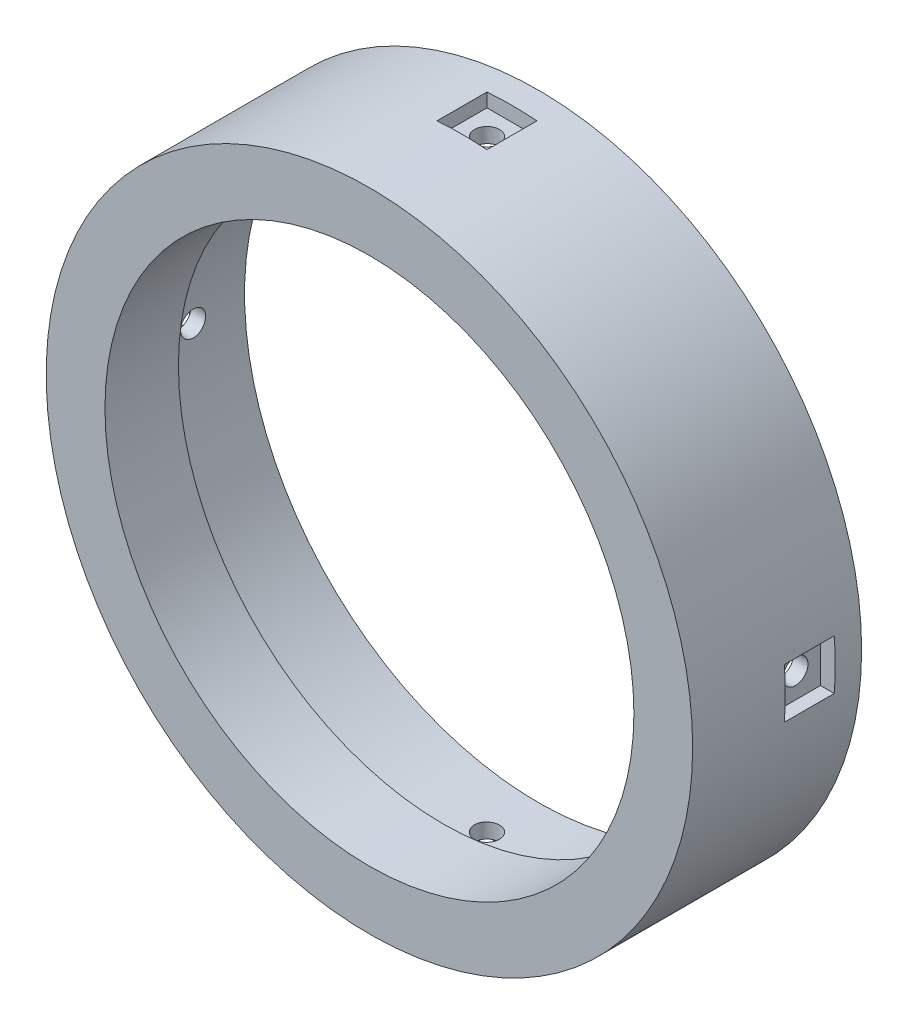
from build123d import *

# Parameters (mm, degrees)
CROQUIS1_R                        = 44
CROQUIS1_R_2                      = 40
MANGA_DEPTH                       = 13
CROQUIS2_R                        = 44
CROQUIS2_R_2                      = 36
LABIO_DEPTH                       = 10
PASANTES_M3_RADIALES_A_DEPTH      = 67.340033162
PASANTES_M3_RADIALES_A_DEPTH_BACK = 67.340033162
CROQUIS3_R                        = 1.7
PASANTES_M3_RADIALES_B_DEPTH      = 67.340033339
PASANTES_M3_RADIALES_B_DEPTH_BACK = 67.340033339
CROQUIS4_R                        = 1.7
CROQUIS10_W                       = 3.5
CROQUIS10_H                       = 6.8
CROQUIS10_W_2                     = 6.8
CROQUIS10_H_2                     = 3.5
PLANOS_M3_TORNILLOS_DEPTH         = 6.8


with BuildPart() as part:
    # Croquis1 → Manga (new body)
    with BuildSketch(Plane.XY):
        with Locations(Location((0, 0, 0), (0, 0, 180))):
            Circle(CROQUIS1_R)
        with Locations(Location((0, 0, 0), (0, 0, 180))):
            Circle(CROQUIS1_R_2, mode=Mode.SUBTRACT)
    extrude(amount=MANGA_DEPTH)

    # Croquis2 → Labio (add)
    with BuildSketch(Plane.XY.offset(13)):
        with Locations(Location((0, 0, 0), (0, 0, 180))):
            Circle(CROQUIS2_R)
        Circle(CROQUIS2_R_2, mode=Mode.SUBTRACT)
    extrude(amount=LABIO_DEPTH)

    # Croquis3 → Pasantes_M3_radiales_A (cut, two sides: drawn at the far end of the back side and taken through both)
    with BuildSketch(Plane(origin=(0, 0, 0), x_dir=(1, 0, 0), z_dir=(0, 1, 0)).offset(-PASANTES_M3_RADIALES_A_DEPTH_BACK)):
        with Locations(Location((0, -7, 0), (0, 0, 270))):
            Circle(CROQUIS3_R)
    extrude(amount=PASANTES_M3_RADIALES_A_DEPTH + PASANTES_M3_RADIALES_A_DEPTH_BACK, mode=Mode.SUBTRACT)

    # Croquis4 → Pasantes_M3_radiales_B (cut, two sides: drawn at the far end of the back side and taken through both)
    with BuildSketch(Plane(origin=(0, 0, 0), x_dir=(0, 0, -1), z_dir=(1, 0, 0)).offset(-PASANTES_M3_RADIALES_B_DEPTH_BACK)):
        with Locations((-7, 0)):
            Circle(CROQUIS4_R)
    extrude(amount=PASANTES_M3_RADIALES_B_DEPTH + PASANTES_M3_RADIALES_B_DEPTH_BACK, mode=Mode.SUBTRACT)

    # Croquis10 → Planos_M3_tornillos (cut)
    with BuildSketch(Plane.XY.offset(3.6)):
        with Locations((43.75, 0)):
            Rectangle(CROQUIS10_W, CROQUIS10_H)
        with Locations((0, 43.75)):
            Rectangle(CROQUIS10_W_2, CROQUIS10_H_2)
        with Locations((-43.75, 0)):
            Rectangle(CROQUIS10_W, CROQUIS10_H)
        with Locations((0, -43.75)):
            Rectangle(CROQUIS10_W_2, CROQUIS10_H_2)
    extrude(amount=PLANOS_M3_TORNILLOS_DEPTH, mode=Mode.SUBTRACT)


solid = part.part
